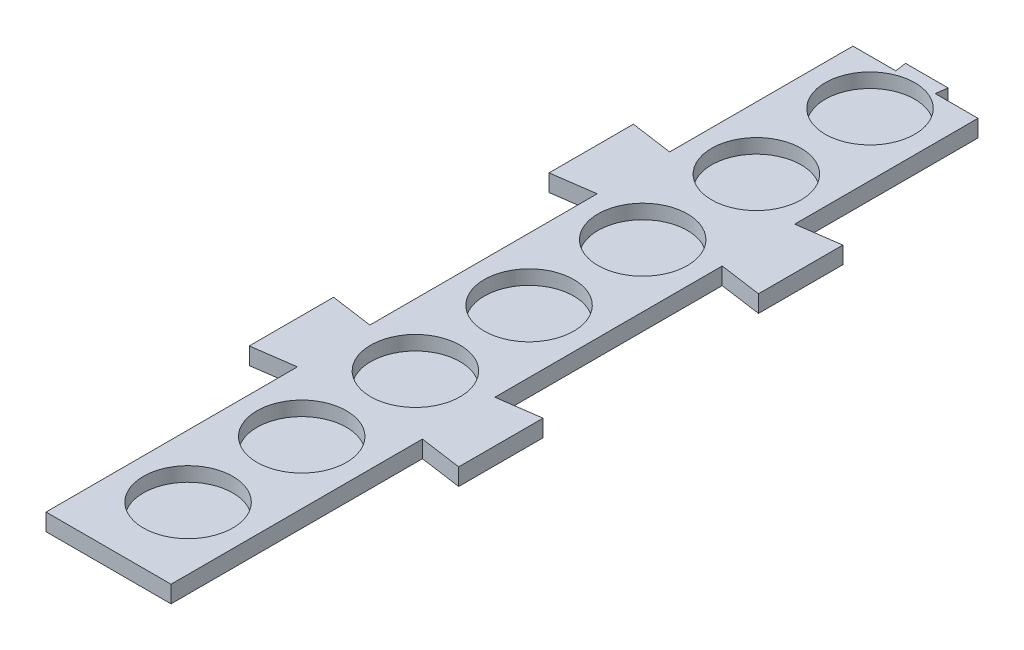
from build123d import *

# Parameters (mm, degrees)
SKETCH1_W           = 27.94
SKETCH1_H           = 391.16
BOSS_EXTRUDE1_DEPTH = 3.81
SKETCH2_R           = 10
CUT_EXTRUDE1_DEPTH  = 3.21
BOSS_EXTRUDE2_DEPTH = 3.81
SKETCH7_W           = 46.80460671
SKETCH7_H           = 3.81
CUT_EXTRUDE2_DEPTH  = 210.82
BOSS_EXTRUDE4_DEPTH = 3.81


with BuildPart() as part:
    # Sketch1 → Boss-Extrude1 (new body)
    with BuildSketch(Plane(origin=(0, 0, 0), x_dir=(1, 0, 0), z_dir=(0, 1, 0))):
        Rectangle(SKETCH1_W, SKETCH1_H)
    extrude(amount=BOSS_EXTRUDE1_DEPTH)

    # Sketch2 → Cut-Extrude1 (cut)
    with BuildSketch(Plane(origin=(0, 3.81, 0), x_dir=(1, 0, 0), z_dir=(0, 1, 0))):
        with Locations((0, 177.8)):
            Circle(SKETCH2_R)
        with Locations((0, 152.4)):
            Circle(SKETCH2_R)
        with Locations((0, 127)):
            Circle(SKETCH2_R)
        with Locations((0, 101.6)):
            Circle(SKETCH2_R)
        with Locations((0, 76.2)):
            Circle(SKETCH2_R)
        with Locations((0, 50.8)):
            Circle(SKETCH2_R)
        with Locations((0, 25.4)):
            Circle(SKETCH2_R)
        Circle(SKETCH2_R)
        with Locations((0, -25.4)):
            Circle(SKETCH2_R)
        with Locations((0, -50.8)):
            Circle(SKETCH2_R)
        with Locations((0, -76.2)):
            Circle(SKETCH2_R)
        with Locations((0, -101.6)):
            Circle(SKETCH2_R)
        with Locations((0, -127)):
            Circle(SKETCH2_R)
        with Locations((0, -152.4)):
            Circle(SKETCH2_R)
        with Locations((0, -177.8)):
            Circle(SKETCH2_R)
    extrude(amount=-CUT_EXTRUDE1_DEPTH, mode=Mode.SUBTRACT)

    # Sketch4 → Boss-Extrude2 (add)
    with BuildSketch(Plane(origin=(0, 0, 0), x_dir=(1, 0, 0), z_dir=(0, 1, 0))):
        Polygon((23.402303355, -54.881033493), (13.97, -56.20665728), (13.97, -72.402209707), (23.402303355, -73.727833493), align=None)
        Polygon((23.402303355, 146.105623787), (13.97, 144.78), (13.97, 128.584447573), (23.402303355, 127.258823787), align=None)
        Polygon((-13.97, 128.584447573), (-13.97, 144.78), (-23.402303355, 146.105623787), (-23.402303355, 127.258823787), align=None)
        Polygon((23.402303355, 79.11007136), (13.97, 77.784447573), (13.97, 61.588895147), (23.402303355, 60.26327136), align=None)
        Polygon((23.402303355, 12.114518933), (13.97, 10.788895147), (13.97, -5.40665728), (23.402303355, -6.732281067), align=None)
        Polygon((-13.97, -5.40665728), (-13.97, 10.788895147), (-23.402303355, 12.114518933), (-23.402303355, -6.732281067), align=None)
        Polygon((-13.97, 61.588895147), (-13.97, 77.784447573), (-23.402303355, 79.11007136), (-23.402303355, 60.26327136), align=None)
        Polygon((23.402303355, -121.87658592), (13.97, -123.202209707), (13.97, -139.397762134), (23.402303355, -140.72338592), align=None)
        Polygon((-13.97, -139.397762134), (-13.97, -123.202209707), (-23.402303355, -121.87658592), (-23.402303355, -140.72338592), align=None)
        Polygon((-13.97, -72.402209707), (-13.97, -56.20665728), (-23.402303355, -54.881033493), (-23.402303355, -73.727833493), align=None)
    extrude(amount=BOSS_EXTRUDE2_DEPTH)

    # Sketch7 → Cut-Extrude2 (cut)
    with BuildSketch(Plane(origin=(0, 0, -195.58), x_dir=(-1, 0, 0), z_dir=(0, 0, -1))):
        with Locations((0, 1.905)):
            Rectangle(SKETCH7_W, SKETCH7_H)
    extrude(amount=-CUT_EXTRUDE2_DEPTH, mode=Mode.SUBTRACT)

    # Sketch8 → Boss-Extrude4 (add)
    with BuildSketch(Plane(origin=(0, 3.81, 0), x_dir=(1, 0, 0), z_dir=(0, 1, 0))):
        Polygon((-4.40552628, -15.24), (-4.7625, -12.7), (4.7625, -12.7), (4.40552628, -15.24), align=None)
    extrude(amount=-BOSS_EXTRUDE4_DEPTH)


solid = part.part
